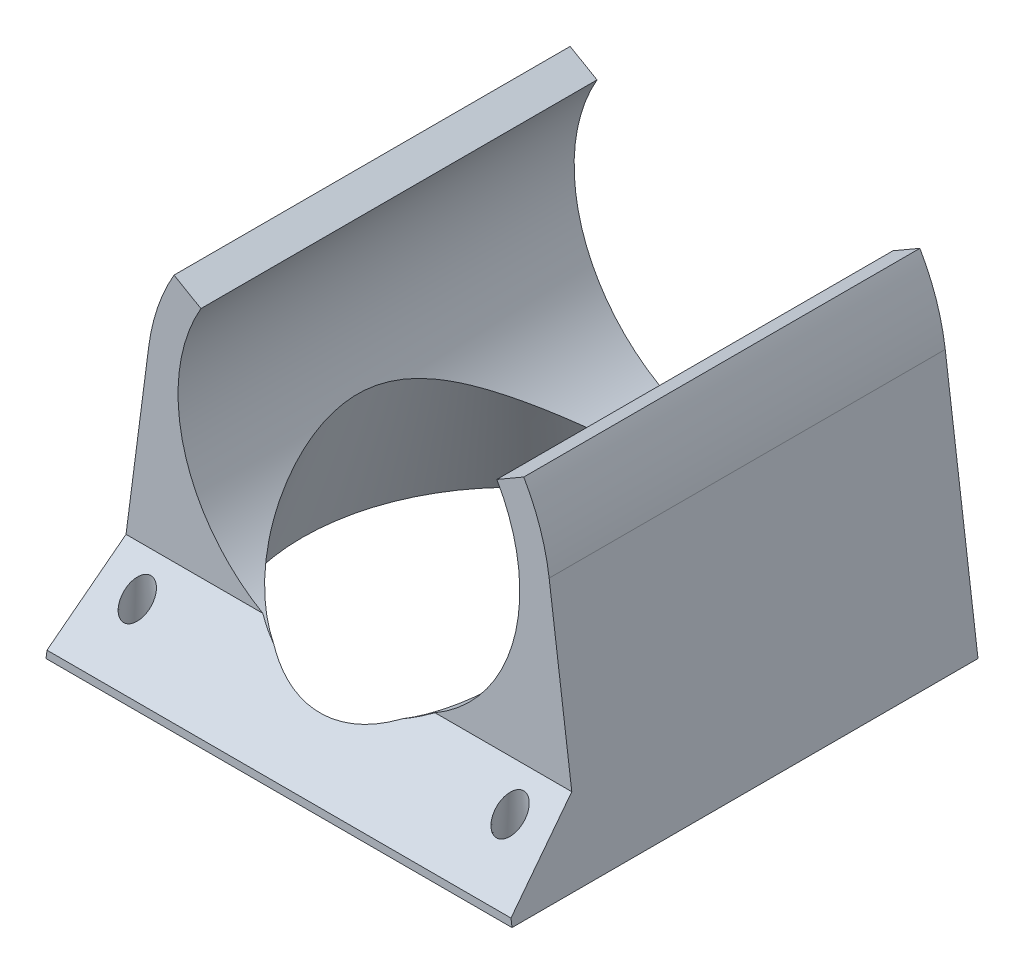
from build123d import *

# Parameters (mm, degrees)
EXTRUDE_1_DEPTH               = 30
CUT_EXTRUDE_1_DEPTH           = 25
SKETCH_4_R                    = 1.35
CUT_EXTRUDE_3_DEPTH           = 8
CUT_EXTRUDE_3_DRAFT           = -8
CUT_EXTRUDE_3_PROFILE_2_DEPTH = 8
CUT_EXTRUDE_3_PROFILE_2_DRAFT = -8
CUT_EXTRUDE_3_PROFILE_3_DEPTH = 8
CUT_EXTRUDE_3_PROFILE_3_DRAFT = -8
CUT_EXTRUDE_3_PROFILE_4_DEPTH = 8
CUT_EXTRUDE_3_PROFILE_4_DRAFT = -8


with BuildPart() as part:
    # 草图1 → 凸台-拉伸1 (new body)
    with BuildSketch(Plane.XY):
        with BuildLine():
            Line((-9.526279442, 5.5), (-11.258330249, 6.5))
            ThreePointArc((-11.258330249, 6.5), (-12.31277123, 4.170811027), (-12.890950792, 1.680293923))
            Line((-12.890950792, 1.680293923), (-15, -14.5))
            Line((-15, -14.5), (15, -14.5))
            Line((15, -14.5), (12.890950792, 1.680293923))
            ThreePointArc((12.890950792, 1.680293923), (12.31277123, 4.170811027), (11.258330249, 6.5))
            Line((11.258330249, 6.5), (9.526279442, 5.5))
            ThreePointArc((9.526279442, 5.5), (0, -11), (-9.526279442, 5.5))
        make_face()
    extrude(amount=EXTRUDE_1_DEPTH)

    # 草图2 → 切除-拉伸1 (cut, symmetric)
    with BuildSketch(Plane(origin=(0, 0, 0), x_dir=(0, 0, -1), z_dir=(1, 0, 0))):
        Polygon((-30, -14), (-25.5, -9.5), (-25.5, 7.359440669), (-30, 7.359440669), align=None)
    extrude(amount=CUT_EXTRUDE_1_DEPTH, both=True, mode=Mode.SUBTRACT)

    # 切除-拉伸2 cone 1 section (through the dimple's axis) → 切除-拉伸2 (revolve, cut)
    with BuildSketch(Plane(origin=(0, -14.5, 15), x_dir=(0, 0, -1), z_dir=(1, 0, 0))):
        Polygon((0, 0), (13.5, 0), (0, 37.090945163), align=None)
    revolve(axis=Axis((0, -14.5, 15), (0, 1, 0)), mode=Mode.SUBTRACT)


with BuildPart() as cut_extrude_3_tool:
    # 草图4 → 切除-拉伸3 (with draft: the straight prism first)
    with BuildSketch(Plane.XZ.offset(14.5)):
        with Locations((-12, 27)):
            Circle(SKETCH_4_R)
    extrude(amount=-CUT_EXTRUDE_3_DEPTH)
    # 切除-拉伸3: the draft: its side faces are tilted about the plane it starts from
    cut_extrude_3_sides = [cut_extrude_3_tool.faces().sort_by_distance(p)[0] for p in [
        (-13.35, -10.5, 27),
    ]]
    draft(cut_extrude_3_sides, Plane.XZ.offset(14.5), CUT_EXTRUDE_3_DRAFT)


with BuildPart() as part_1:
    add(part.part)

    # 切除-拉伸3: cut by cut_extrude_3_tool
    add(cut_extrude_3_tool.part, mode=Mode.SUBTRACT)


with BuildPart() as cut_extrude_3_profile_2_tool:
    # 草图4 → 切除-拉伸3 profile 2 (with draft: the straight prism first)
    with BuildSketch(Plane.XZ.offset(14.5)):
        with Locations((12, 27)):
            Circle(SKETCH_4_R)
    extrude(amount=-CUT_EXTRUDE_3_PROFILE_2_DEPTH)
    # 切除-拉伸3 profile 2: the draft: its side faces are tilted about the plane it starts from
    cut_extrude_3_profile_2_sides = [cut_extrude_3_profile_2_tool.faces().sort_by_distance(p)[0] for p in [
        (10.65, -10.5, 27),
    ]]
    draft(cut_extrude_3_profile_2_sides, Plane.XZ.offset(14.5), CUT_EXTRUDE_3_PROFILE_2_DRAFT)


with BuildPart() as part_2:
    add(part_1.part)

    # 切除-拉伸3 profile 2: cut by cut_extrude_3_profile_2_tool
    add(cut_extrude_3_profile_2_tool.part, mode=Mode.SUBTRACT)


with BuildPart() as cut_extrude_3_profile_3_tool:
    # 草图4 → 切除-拉伸3 profile 3 (with draft: the straight prism first)
    with BuildSketch(Plane.XZ.offset(14.5)):
        with Locations((-12, 3)):
            Circle(SKETCH_4_R)
    extrude(amount=-CUT_EXTRUDE_3_PROFILE_3_DEPTH)
    # 切除-拉伸3 profile 3: the draft: its side faces are tilted about the plane it starts from
    cut_extrude_3_profile_3_sides = [cut_extrude_3_profile_3_tool.faces().sort_by_distance(p)[0] for p in [
        (-13.35, -10.5, 3),
    ]]
    draft(cut_extrude_3_profile_3_sides, Plane.XZ.offset(14.5), CUT_EXTRUDE_3_PROFILE_3_DRAFT)


with BuildPart() as part_3:
    add(part_2.part)

    # 切除-拉伸3 profile 3: cut by cut_extrude_3_profile_3_tool
    add(cut_extrude_3_profile_3_tool.part, mode=Mode.SUBTRACT)


with BuildPart() as cut_extrude_3_profile_4_tool:
    # 草图4 → 切除-拉伸3 profile 4 (with draft: the straight prism first)
    with BuildSketch(Plane.XZ.offset(14.5)):
        with Locations((12, 3)):
            Circle(SKETCH_4_R)
    extrude(amount=-CUT_EXTRUDE_3_PROFILE_4_DEPTH)
    # 切除-拉伸3 profile 4: the draft: its side faces are tilted about the plane it starts from
    cut_extrude_3_profile_4_sides = [cut_extrude_3_profile_4_tool.faces().sort_by_distance(p)[0] for p in [
        (10.65, -10.5, 3),
    ]]
    draft(cut_extrude_3_profile_4_sides, Plane.XZ.offset(14.5), CUT_EXTRUDE_3_PROFILE_4_DRAFT)


with BuildPart() as part_4:
    add(part_3.part)

    # 切除-拉伸3 profile 4: cut by cut_extrude_3_profile_4_tool
    add(cut_extrude_3_profile_4_tool.part, mode=Mode.SUBTRACT)


solid = part_4.part
